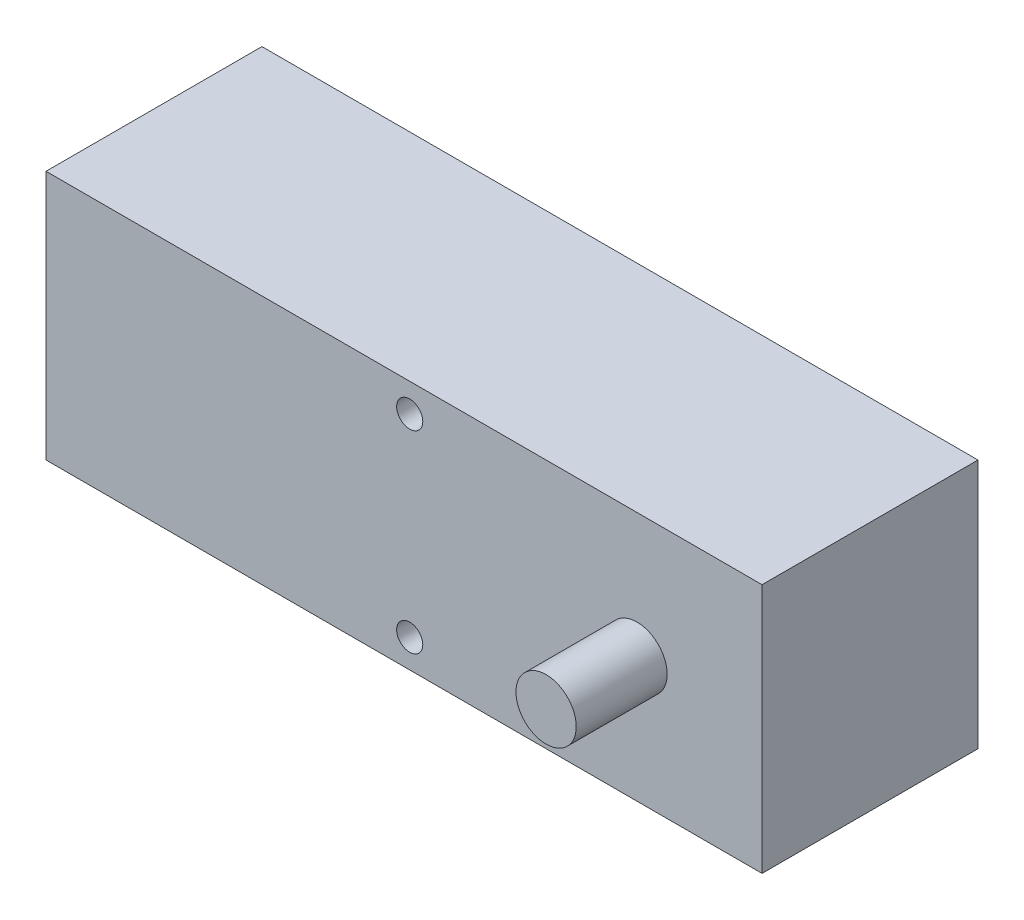
from build123d import *

# Parameters (mm, degrees)
SKETCH1_W           = 63
SKETCH1_H           = 22
SKETCH1_R           = 1.15
BOSS_EXTRUDE1_DEPTH = 19
SKETCH2_R           = 2.65
BOSS_EXTRUDE2_DEPTH = 8


with BuildPart() as part:
    # Sketch1 → Boss-Extrude1 (new body)
    with BuildSketch(Plane.XY):
        with Locations((31.5, 11)):
            Rectangle(SKETCH1_W, SKETCH1_H)
        with Locations((32, 19.5)):
            Circle(SKETCH1_R, mode=Mode.SUBTRACT)
        with Locations((32, 2.5)):
            Circle(SKETCH1_R, mode=Mode.SUBTRACT)
    extrude(amount=BOSS_EXTRUDE1_DEPTH)

    # Sketch2 → Boss-Extrude2 (add)
    with BuildSketch(Plane.XY.offset(19)):
        with Locations(Location((52, 11, 0), (0, 0, 180))):
            Circle(SKETCH2_R)
    extrude(amount=BOSS_EXTRUDE2_DEPTH)


solid = part.part
